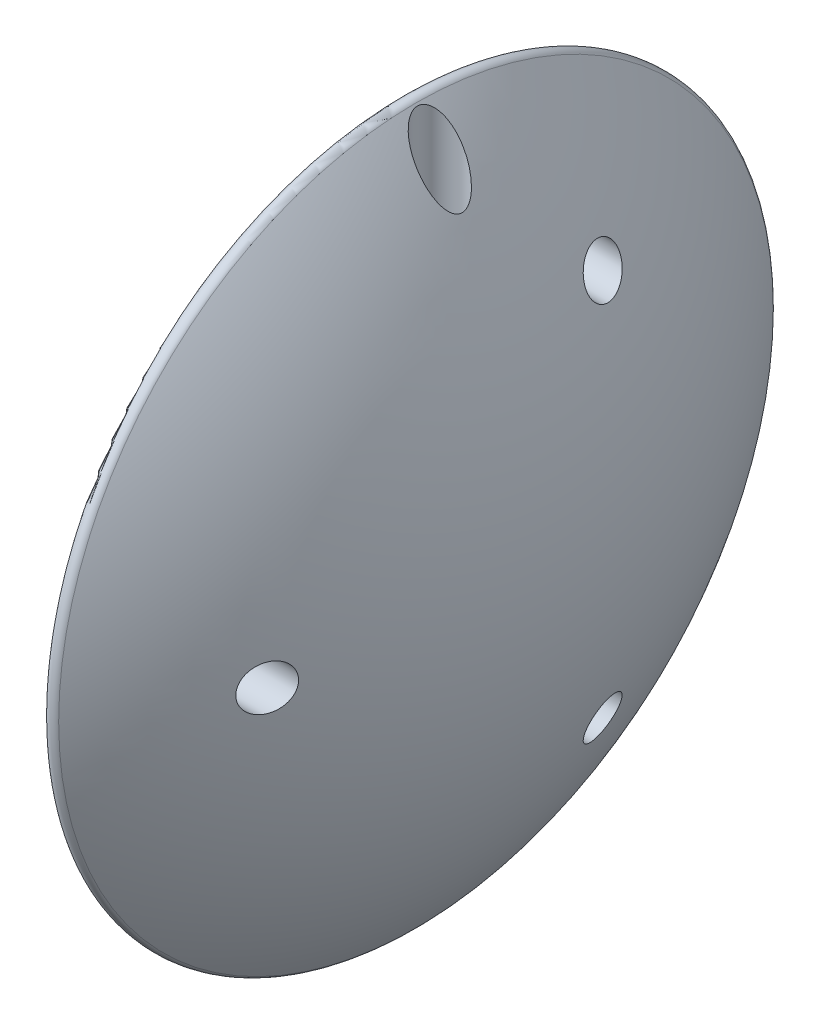
from build123d import *

# Parameters (mm, degrees)
CUT_EXTRUDE1_DEPTH      = 15
SKETCH3_R               = 1.4
CUT_EXTRUDE2_DEPTH      = 108.716624848
CUT_EXTRUDE3_START      = -20
SKETCH4_R               = 3
CUT_EXTRUDE3_DEPTH      = 88.716624907
FILLET1_R               = 1
CHAMFER1_SIZE           = 1
CUT_EXTRUDE4_DEPTH      = 71.620610943
CUT_EXTRUDE4_DEPTH_BACK = 71.620610943
SKETCH5_R               = 1.4
SKETCH5_R_2             = 1.400000586
CUT_EXTRUDE5_START      = -5
SKETCH6_R               = 3
CUT_EXTRUDE5_DEPTH      = 10


with BuildPart() as part:
    # Sketch1 → Revolve1 (revolve)
    with BuildSketch(Plane.XY):
        with BuildLine():
            Line((62.25, 50.248756204), (62.25, 0))
            Line((62.25, 0), (80, 0))
            ThreePointArc((80, 0), (75.432088663, 26.645825189), (62.25, 50.248756204))
        make_face()
    revolve(axis=Axis((62.25, 0, 0), (1, 0, 0)))

    # Sketch2 → Cut-Extrude1 (cut)
    with BuildSketch(Plane.ZY.offset(-62.25)):
        with BuildLine():
            Line((-1.322875656, 1.5), (1.322875656, 1.5))
            ThreePointArc((1.322875656, 1.5), (0, -2), (-1.322875656, 1.5))
        make_face()
    extrude(amount=-CUT_EXTRUDE1_DEPTH, mode=Mode.SUBTRACT)

    # Sketch3 → Cut-Extrude2 (cut, through all)
    with BuildSketch(Plane.XZ.offset(-1.5)):
        with Locations(Location((67.25, 0, 0), (0, 0, 289.106605351))):
            Circle(SKETCH3_R)
    extrude(amount=-CUT_EXTRUDE2_DEPTH, mode=Mode.SUBTRACT)

    # Sketch4 → Cut-Extrude3 (cut, through all)
    with BuildSketch(Plane.XZ.offset(-1.5).offset(CUT_EXTRUDE3_START)):
        with Locations(Location((67.25, 0, 0), (0, 0, 270))):
            Circle(SKETCH4_R)
    extrude(amount=-CUT_EXTRUDE3_DEPTH, mode=Mode.SUBTRACT)

    # Fillet1
    fillet1_edges = [part.edges().sort_by_distance(p)[0] for p in [
        (62.25, -50.248756204, 0),
    ]]
    fillet(fillet1_edges, radius=FILLET1_R)

    # Chamfer1
    chamfer1_edges = [part.edges().sort_by_distance(p)[0] for p in [
        (62.25, -2, 0),
        (62.25, 1.5, 0),
    ]]
    chamfer(chamfer1_edges, length=CHAMFER1_SIZE)

    # Sketch5 → Cut-Extrude4 (cut, two sides: drawn at the far end of the back side and taken through both)
    with BuildSketch(Plane.ZY.offset(-62.25).offset(-CUT_EXTRUDE4_DEPTH_BACK)):
        with Locations(Location((-15, -25.980762114, 0), (0, 0, 214.536292373))):
            Circle(SKETCH5_R)
        with Locations(Location((30, 0, 0), (0, 0, 317.351415887))):
            Circle(SKETCH5_R_2)
        with Locations(Location((-15, 25.980762114, 0), (0, 0, 191.339464894))):
            Circle(SKETCH5_R)
    extrude(amount=CUT_EXTRUDE4_DEPTH + CUT_EXTRUDE4_DEPTH_BACK, mode=Mode.SUBTRACT)

    # Sketch6 → Cut-Extrude5 (cut)
    with BuildSketch(Plane.ZY.offset(-62.25).offset(CUT_EXTRUDE5_START)):
        with Locations((-15, 25.980762114)):
            Circle(SKETCH6_R)
        with Locations((30, 0)):
            Circle(SKETCH6_R)
        with Locations((-15, -25.980762114)):
            Circle(SKETCH6_R)
    extrude(amount=-CUT_EXTRUDE5_DEPTH, mode=Mode.SUBTRACT)


solid = part.part
